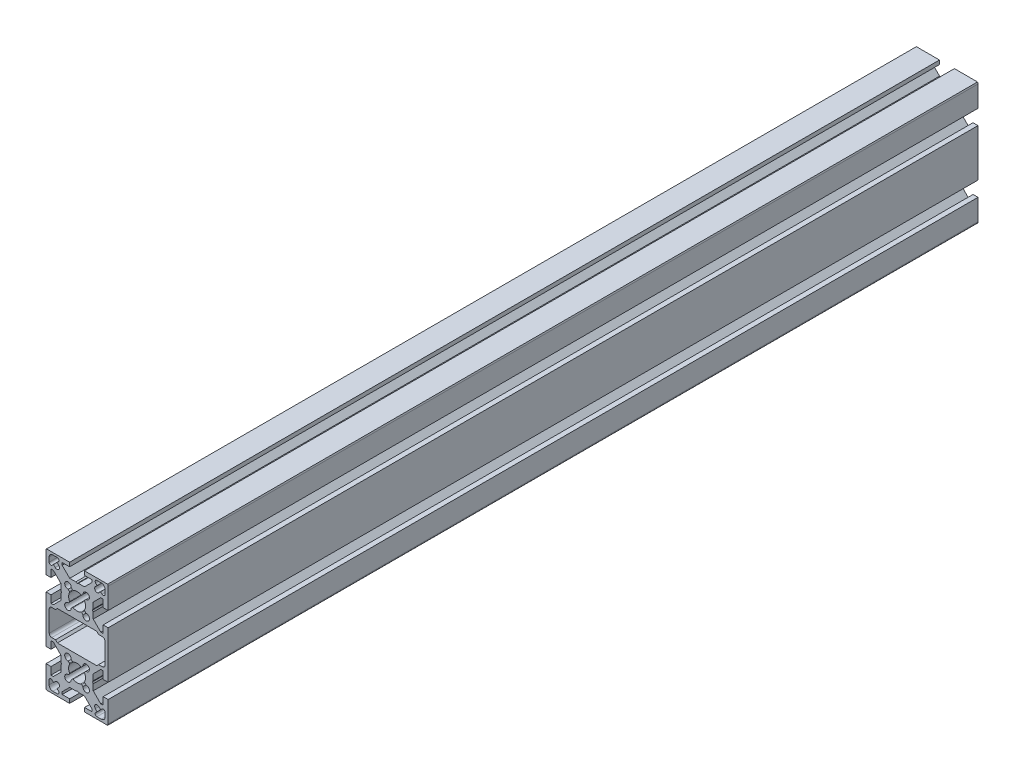
from build123d import *

# Parameters (mm, degrees)
BOSS_EXTRUDE1_DEPTH = 350


with BuildPart() as part:
    # Sketch1 → Boss-Extrude1 (new body)
    with BuildSketch(Plane(origin=(0, 0, -350), x_dir=(-1, 0, 0), z_dir=(0, 0, -1))):
        with BuildLine():
            Line((12.5, -15.5), (10.5, -15.5))
            Line((10.5, -15.5), (10.5, -18.5))
            Line((10.5, -18.5), (9.535533906, -18.5))
            Line((9.535533906, -18.5), (6.5, -15.464466094))
            Line((6.5, -15.464466094), (6.5, -13.019615242))
            Line((6.5, -13.019615242), (6.2, -12.5))
            Line((6.2, -12.5), (6.5, -11.980384758))
            Line((6.5, -11.980384758), (6.5, -9.535533906))
            Line((6.5, -9.535533906), (9.535533906, -6.5))
            Line((9.535533906, -6.5), (10.5, -6.5))
            Line((10.5, -6.5), (10.5, -9.5))
            Line((10.5, -9.5), (12.5, -9.5))
            Line((12.5, -9.5), (12.5, 9.5))
            Line((12.5, 9.5), (10.5, 9.5))
            Line((10.5, 9.5), (10.5, 6.5))
            Line((10.5, 6.5), (9.535533906, 6.5))
            Line((9.535533906, 6.5), (6.5, 9.535533906))
            Line((6.5, 9.535533906), (6.5, 11.980384758))
            Line((6.5, 11.980384758), (6.2, 12.5))
            Line((6.2, 12.5), (6.5, 13.019615242))
            Line((6.5, 13.019615242), (6.5, 15.464466094))
            Line((6.5, 15.464466094), (9.535533906, 18.5))
            Line((9.535533906, 18.5), (10.5, 18.5))
            Line((10.5, 18.5), (10.5, 15.5))
            Line((10.5, 15.5), (12.5, 15.5))
            Line((12.5, 15.5), (12.5, 24))
            ThreePointArc((12.5, 24), (12.448683298, 24.316227766), (12.3, 24.6))
            Line((12.3, 24.6), (3, 24.6))
            Line((3, 24.6), (3, 23))
            Line((3, 23), (6, 23))
            Line((6, 23), (6, 22.035533906))
            Line((6, 22.035533906), (2.964466094, 19))
            Line((2.964466094, 19), (0.519615242, 19))
            Line((0.519615242, 19), (0, 18.7))
            Line((0, 18.7), (-0.519615242, 19))
            Line((-0.519615242, 19), (-2.964466094, 19))
            Line((-2.964466094, 19), (-6, 22.035533906))
            Line((-6, 22.035533906), (-6, 23))
            Line((-6, 23), (-3, 23))
            Line((-3, 23), (-3, 24.6))
            Line((-3, 24.6), (-12.3, 24.6))
            ThreePointArc((-12.3, 24.6), (-12.448683298, 24.316227766), (-12.5, 24))
            Line((-12.5, 24), (-12.5, 15.5))
            Line((-12.5, 15.5), (-10.5, 15.5))
            Line((-10.5, 15.5), (-10.5, 18.5))
            Line((-10.5, 18.5), (-9.535533906, 18.5))
            Line((-9.535533906, 18.5), (-6.5, 15.464466094))
            Line((-6.5, 15.464466094), (-6.5, 13.019615242))
            Line((-6.5, 13.019615242), (-6.2, 12.5))
            Line((-6.2, 12.5), (-6.5, 11.980384758))
            Line((-6.5, 11.980384758), (-6.5, 9.535533906))
            Line((-6.5, 9.535533906), (-9.535533906, 6.5))
            Line((-9.535533906, 6.5), (-10.5, 6.5))
            Line((-10.5, 6.5), (-10.5, 9.5))
            Line((-10.5, 9.5), (-12.5, 9.5))
            Line((-12.5, 9.5), (-12.5, -9.5))
            Line((-12.5, -9.5), (-10.5, -9.5))
            Line((-10.5, -9.5), (-10.5, -6.5))
            Line((-10.5, -6.5), (-9.535533906, -6.5))
            Line((-9.535533906, -6.5), (-6.5, -9.535533906))
            Line((-6.5, -9.535533906), (-6.5, -11.980384758))
            Line((-6.5, -11.980384758), (-6.2, -12.5))
            Line((-6.2, -12.5), (-6.5, -13.019615242))
            Line((-6.5, -13.019615242), (-6.5, -15.464466094))
            Line((-6.5, -15.464466094), (-9.535533906, -18.5))
            Line((-9.535533906, -18.5), (-10.5, -18.5))
            Line((-10.5, -18.5), (-10.5, -15.5))
            Line((-10.5, -15.5), (-12.5, -15.5))
            Line((-12.5, -15.5), (-12.5, -24))
            ThreePointArc((-12.5, -24), (-12.448683298, -24.316227766), (-12.3, -24.6))
            Line((-12.3, -24.6), (-3, -24.6))
            Line((-3, -24.6), (-3, -23))
            Line((-3, -23), (-6, -23))
            Line((-6, -23), (-6, -22.035533906))
            Line((-6, -22.035533906), (-2.964466094, -19))
            Line((-2.964466094, -19), (-0.519615242, -19))
            Line((-0.519615242, -19), (0, -18.7))
            Line((0, -18.7), (0.519615242, -19))
            Line((0.519615242, -19), (2.964466094, -19))
            Line((2.964466094, -19), (6, -22.035533906))
            Line((6, -22.035533906), (6, -23))
            Line((6, -23), (3, -23))
            Line((3, -23), (3, -24.6))
            Line((3, -24.6), (12.3, -24.6))
            ThreePointArc((12.3, -24.6), (12.448683298, -24.316227766), (12.5, -24))
            Line((12.5, -24), (12.5, -15.5))
        make_face()
        with BuildLine():
            Line((11.2, 4.25), (11.2, -4.25))
            ThreePointArc((11.2, -4.25), (10.907106781, -4.957106781), (10.2, -5.25))
            Line((10.2, -5.25), (8.664213562, -5.25))
            Line((8.664213562, -5.25), (7.914213562, -6))
            Line((7.914213562, -6), (-7.914213562, -6))
            Line((-7.914213562, -6), (-8.664213562, -5.25))
            Line((-8.664213562, -5.25), (-10.2, -5.25))
            ThreePointArc((-10.2, -5.25), (-10.907106781, -4.957106781), (-11.2, -4.25))
            Line((-11.2, -4.25), (-11.2, 4.25))
            ThreePointArc((-11.2, 4.25), (-10.907106781, 4.957106781), (-10.2, 5.25))
            Line((-10.2, 5.25), (-8.664213562, 5.25))
            Line((-8.664213562, 5.25), (-7.914213562, 6))
            Line((-7.914213562, 6), (7.914213562, 6))
            Line((7.914213562, 6), (8.664213562, 5.25))
            Line((8.664213562, 5.25), (10.2, 5.25))
            ThreePointArc((10.2, 5.25), (10.907106781, 4.957106781), (11.2, 4.25))
        make_face(mode=Mode.SUBTRACT)
        with BuildLine():
            Line((3.087755464, -14.385673936), (3.582474639, -14.880393111))
            ThreePointArc((3.582474639, -14.880393111), (4.596194078, -17.096194078), (2.380393111, -16.082474639))
            Line((2.380393111, -16.082474639), (1.885673936, -15.587755464))
            ThreePointArc((1.885673936, -15.587755464), (1.720751743, -15.5036254), (1.537849315, -15.532329053))
            ThreePointArc((1.537849315, -15.532329053), (0, -15.9), (-1.537849315, -15.532329053))
            ThreePointArc((-1.537849315, -15.532329053), (-1.720751743, -15.5036254), (-1.885673936, -15.587755464))
            Line((-1.885673936, -15.587755464), (-2.380393111, -16.082474639))
            ThreePointArc((-2.380393111, -16.082474639), (-4.596194078, -17.096194078), (-3.582474639, -14.880393111))
            Line((-3.582474639, -14.880393111), (-3.087755464, -14.385673936))
            ThreePointArc((-3.087755464, -14.385673936), (-3.0036254, -14.220751743), (-3.032329053, -14.037849315))
            ThreePointArc((-3.032329053, -14.037849315), (-3.4, -12.5), (-3.032329053, -10.962150685))
            ThreePointArc((-3.032329053, -10.962150685), (-3.0036254, -10.779248257), (-3.087755464, -10.614326064))
            Line((-3.087755464, -10.614326064), (-3.582474639, -10.119606889))
            ThreePointArc((-3.582474639, -10.119606889), (-4.596194078, -7.903805922), (-2.380393111, -8.917525361))
            Line((-2.380393111, -8.917525361), (-1.885673936, -9.412244536))
            ThreePointArc((-1.885673936, -9.412244536), (-1.720751743, -9.4963746), (-1.537849315, -9.467670947))
            ThreePointArc((-1.537849315, -9.467670947), (0, -9.1), (1.537849315, -9.467670947))
            ThreePointArc((1.537849315, -9.467670947), (1.720751743, -9.4963746), (1.885673936, -9.412244536))
            Line((1.885673936, -9.412244536), (2.380393111, -8.917525361))
            ThreePointArc((2.380393111, -8.917525361), (4.596194078, -7.903805922), (3.582474639, -10.119606889))
            Line((3.582474639, -10.119606889), (3.087755464, -10.614326064))
            ThreePointArc((3.087755464, -10.614326064), (3.0036254, -10.779248257), (3.032329053, -10.962150685))
            ThreePointArc((3.032329053, -10.962150685), (3.4, -12.5), (3.032329053, -14.037849315))
            ThreePointArc((3.032329053, -14.037849315), (3.0036254, -14.220751743), (3.087755464, -14.385673936))
        make_face(mode=Mode.SUBTRACT)
        with BuildLine():
            Line((3.087755464, 10.614326064), (3.582474639, 10.119606889))
            ThreePointArc((3.582474639, 10.119606889), (4.596194078, 7.903805922), (2.380393111, 8.917525361))
            Line((2.380393111, 8.917525361), (1.885673936, 9.412244536))
            ThreePointArc((1.885673936, 9.412244536), (1.720751743, 9.4963746), (1.537849315, 9.467670947))
            ThreePointArc((1.537849315, 9.467670947), (0, 9.1), (-1.537849315, 9.467670947))
            ThreePointArc((-1.537849315, 9.467670947), (-1.720751743, 9.4963746), (-1.885673936, 9.412244536))
            Line((-1.885673936, 9.412244536), (-2.380393111, 8.917525361))
            ThreePointArc((-2.380393111, 8.917525361), (-4.596194078, 7.903805922), (-3.582474639, 10.119606889))
            Line((-3.582474639, 10.119606889), (-3.087755464, 10.614326064))
            ThreePointArc((-3.087755464, 10.614326064), (-3.0036254, 10.779248257), (-3.032329053, 10.962150685))
            ThreePointArc((-3.032329053, 10.962150685), (-3.4, 12.5), (-3.032329053, 14.037849315))
            ThreePointArc((-3.032329053, 14.037849315), (-3.0036254, 14.220751743), (-3.087755464, 14.385673936))
            Line((-3.087755464, 14.385673936), (-3.582474639, 14.880393111))
            ThreePointArc((-3.582474639, 14.880393111), (-4.596194078, 17.096194078), (-2.380393111, 16.082474639))
            Line((-2.380393111, 16.082474639), (-1.885673936, 15.587755464))
            ThreePointArc((-1.885673936, 15.587755464), (-1.720751743, 15.5036254), (-1.537849315, 15.532329053))
            ThreePointArc((-1.537849315, 15.532329053), (0, 15.9), (1.537849315, 15.532329053))
            ThreePointArc((1.537849315, 15.532329053), (1.720751743, 15.5036254), (1.885673936, 15.587755464))
            Line((1.885673936, 15.587755464), (2.380393111, 16.082474639))
            ThreePointArc((2.380393111, 16.082474639), (4.596194078, 17.096194078), (3.582474639, 14.880393111))
            Line((3.582474639, 14.880393111), (3.087755464, 14.385673936))
            ThreePointArc((3.087755464, 14.385673936), (3.0036254, 14.220751743), (3.032329053, 14.037849315))
            ThreePointArc((3.032329053, 14.037849315), (3.4, 12.5), (3.032329053, 10.962150685))
            ThreePointArc((3.032329053, 10.962150685), (3.0036254, 10.779248257), (3.087755464, 10.614326064))
        make_face(mode=Mode.SUBTRACT)
        with BuildLine():
            Line((11.25, -20.476197667), (11.25, -22.25))
            ThreePointArc((11.25, -22.25), (10.810660172, -23.310660172), (9.75, -23.75))
            Line((9.75, -23.75), (7.976197667, -23.75))
            ThreePointArc((7.976197667, -23.75), (7.329481994, -23.317878403), (7.48122292, -22.555025253))
            Line((7.48122292, -22.555025253), (8.061017306, -21.975230868))
            Line((8.061017306, -21.975230868), (7.353910524, -21.268124087))
            ThreePointArc((7.353910524, -21.268124087), (7.353910524, -19.853910524), (8.768124087, -19.853910524))
            Line((8.768124087, -19.853910524), (9.475230868, -20.561017306))
            Line((9.475230868, -20.561017306), (10.055025253, -19.98122292))
            ThreePointArc((10.055025253, -19.98122292), (10.817878403, -19.829481994), (11.25, -20.476197667))
        make_face(mode=Mode.SUBTRACT)
        with BuildLine():
            Line((-9.475230868, -20.561017306), (-8.768124128, -19.853910565))
            ThreePointArc((-8.768124128, -19.853910565), (-7.353910565, -19.853910565), (-7.353910565, -21.268124128))
            Line((-7.353910565, -21.268124128), (-8.061017306, -21.975230868))
            Line((-8.061017306, -21.975230868), (-7.48122292, -22.555025253))
            ThreePointArc((-7.48122292, -22.555025253), (-7.329481994, -23.317878403), (-7.976197667, -23.75))
            Line((-7.976197667, -23.75), (-9.75, -23.75))
            ThreePointArc((-9.75, -23.75), (-10.810660172, -23.310660172), (-11.25, -22.25))
            Line((-11.25, -22.25), (-11.25, -20.476197667))
            ThreePointArc((-11.25, -20.476197667), (-10.817878403, -19.829481994), (-10.055025253, -19.98122292))
            Line((-10.055025253, -19.98122292), (-9.475230868, -20.561017306))
        make_face(mode=Mode.SUBTRACT)
        with BuildLine():
            Line((-8.061017306, 21.975230868), (-7.353910578, 21.26812414))
            ThreePointArc((-7.353910578, 21.26812414), (-7.353910578, 19.853910578), (-8.76812414, 19.853910578))
            Line((-8.76812414, 19.853910578), (-9.475230868, 20.561017306))
            Line((-9.475230868, 20.561017306), (-10.055025253, 19.98122292))
            ThreePointArc((-10.055025253, 19.98122292), (-10.817878403, 19.829481994), (-11.25, 20.476197667))
            Line((-11.25, 20.476197667), (-11.25, 22.25))
            ThreePointArc((-11.25, 22.25), (-10.810660172, 23.310660172), (-9.75, 23.75))
            Line((-9.75, 23.75), (-7.976197667, 23.75))
            ThreePointArc((-7.976197667, 23.75), (-7.329481994, 23.317878403), (-7.48122292, 22.555025253))
            Line((-7.48122292, 22.555025253), (-8.061017306, 21.975230868))
        make_face(mode=Mode.SUBTRACT)
        with BuildLine():
            Line((11.25, 22.25), (11.25, 20.476197667))
            ThreePointArc((11.25, 20.476197667), (10.817878403, 19.829481994), (10.055025253, 19.98122292))
            Line((10.055025253, 19.98122292), (9.475230868, 20.561017306))
            Line((9.475230868, 20.561017306), (8.768124087, 19.853910524))
            ThreePointArc((8.768124087, 19.853910524), (7.353910524, 19.853910524), (7.353910524, 21.268124087))
            Line((7.353910524, 21.268124087), (8.061017306, 21.975230868))
            Line((8.061017306, 21.975230868), (7.48122292, 22.555025253))
            ThreePointArc((7.48122292, 22.555025253), (7.329481994, 23.317878403), (7.976197667, 23.75))
            Line((7.976197667, 23.75), (9.75, 23.75))
            ThreePointArc((9.75, 23.75), (10.810660172, 23.310660172), (11.25, 22.25))
        make_face(mode=Mode.SUBTRACT)
    extrude(amount=-BOSS_EXTRUDE1_DEPTH)


solid = part.part
